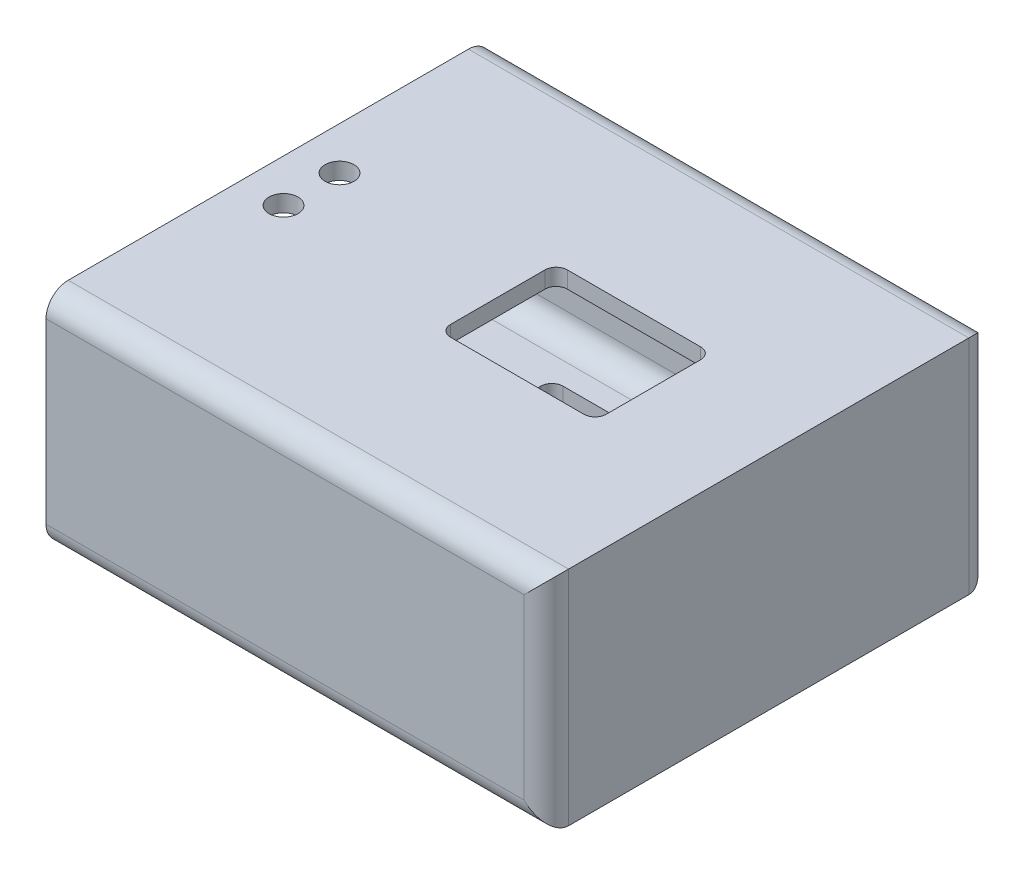
from build123d import *

# Parameters (mm, degrees)
SKETCH1_W           = 50.8
SKETCH1_H           = 25.4
BOSS_EXTRUDE1_DEPTH = 57.15
SHELL1_T            = -1.905
SKETCH2_W           = 17.78
SKETCH2_H           = 13.335
CUT_EXTRUDE1_DEPTH  = 12.7
SKETCH3_W           = 31.75
SKETCH3_H           = 10.16
CUT_EXTRUDE2_DEPTH  = 12.7
FILLET1_R           = 2.54
FILLET2_R           = 1.27
FILLET3_R           = 1.27
SKETCH5_R           = 1.651
CUT_EXTRUDE3_DEPTH  = 2.54


with BuildPart() as part:
    # Sketch1 → Boss-Extrude1 (new body)
    with BuildSketch(Plane(origin=(0, 0, 0), x_dir=(0, 0, -1), z_dir=(1, 0, 0))):
        Rectangle(SKETCH1_W, SKETCH1_H)
    extrude(amount=BOSS_EXTRUDE1_DEPTH)

    # Shell1
    shell1_openings = [part.faces().sort_by_distance(p)[0] for p in [
        (0, 0, 0),
    ]]
    offset(amount=SHELL1_T, openings=shell1_openings, kind=Kind.INTERSECTION)

    # Sketch2 → Cut-Extrude1 (cut)
    with BuildSketch(Plane(origin=(0, 12.7, 0), x_dir=(1, 0, 0), z_dir=(0, 1, 0))):
        with Locations((35.0974914, 0)):
            Rectangle(SKETCH2_W, SKETCH2_H)
    extrude(amount=-CUT_EXTRUDE1_DEPTH, mode=Mode.SUBTRACT)

    # Sketch3 → Cut-Extrude2 (cut)
    with BuildSketch(Plane.XZ.offset(12.7)):
        with Locations((29.845, -13.335)):
            Rectangle(SKETCH3_W, SKETCH3_H)
    extrude(amount=-CUT_EXTRUDE2_DEPTH, mode=Mode.SUBTRACT)

    # Fillet1
    fillet1_edges = [part.edges().sort_by_distance(p)[0] for p in [
        (57.15, 0, 25.4),
        (27.6225, -10.795, -23.495),
        (27.6225, 10.795, -23.495),
        (27.6225, 10.795, 23.495),
        (27.6225, -10.795, 23.495),
        (57.15, 0, -25.4),
        (28.575, -12.7, -25.4),
        (28.575, -12.7, 25.4),
        (28.575, 12.7, 25.4),
        (28.575, 12.7, -25.4),
    ]]
    fillet(fillet1_edges, radius=FILLET1_R)

    # Fillet2
    fillet2_edges = [part.edges().sort_by_distance(p)[0] for p in [
        (26.2074914, 11.7475, 6.6675),
        (26.2074914, 11.7475, -6.6675),
        (43.9874914, 11.7475, -6.6675),
        (43.9874914, 11.7475, 6.6675),
    ]]
    fillet(fillet2_edges, radius=FILLET2_R)

    # Fillet3
    fillet3_edges = [part.edges().sort_by_distance(p)[0] for p in [
        (45.72, -11.7475, -8.255),
        (45.72, -11.7475, -18.415),
        (13.97, -11.7475, -18.415),
        (13.97, -11.7475, -8.255),
    ]]
    fillet(fillet3_edges, radius=FILLET3_R)

    # Sketch5 → Cut-Extrude3 (cut)
    with BuildSketch(Plane(origin=(0, 12.7, 0), x_dir=(1, 0, 0), z_dir=(0, 1, 0))):
        with Locations(Location((4.8875, 3.243405994, 0), (0, 0, 270))):
            Circle(SKETCH5_R)
        with Locations(Location((4.8875, -3.156594006, 0), (0, 0, 270))):
            Circle(SKETCH5_R)
    extrude(amount=-CUT_EXTRUDE3_DEPTH, mode=Mode.SUBTRACT)


solid = part.part
